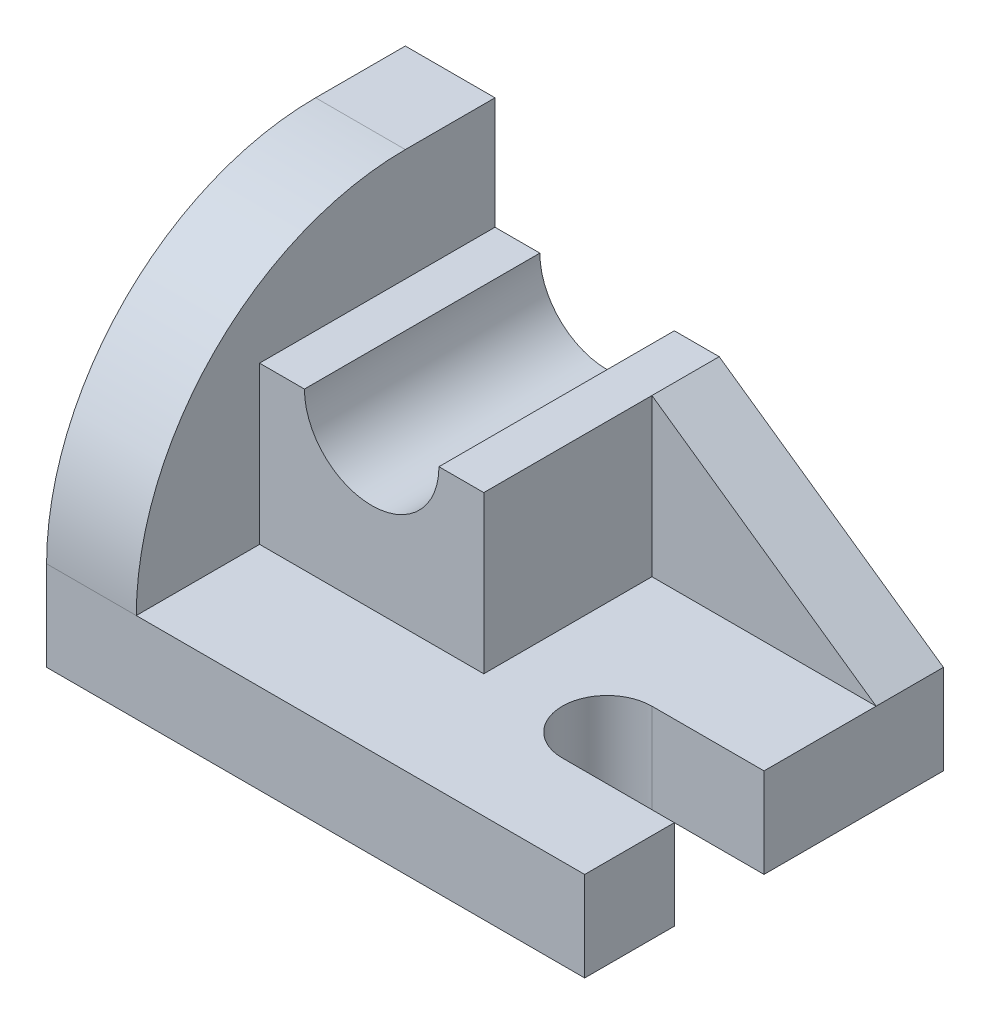
from build123d import *

# Parameters (mm, degrees)
BOSS_EXTRUDE5_DEPTH = 16
BOSS_EXTRUDE6_DEPTH = 16
BOSS_EXTRUDE7_DEPTH = 42
BOSS_EXTRUDE8_DEPTH = 12


with BuildPart() as part:
    # Sketch1 → Boss-Extrude5 (new body)
    with BuildSketch(Plane(origin=(0, 0, 0), x_dir=(1, 0, 0), z_dir=(0, 1, 0))):
        with BuildLine():
            Line((0, 0), (96, 0))
            Line((96, 0), (96, 16))
            Line((96, 16), (76, 16))
            ThreePointArc((76, 16), (68, 24), (76, 32))
            Line((76, 32), (96, 32))
            Line((96, 32), (96, 64))
            Line((96, 64), (0, 64))
            Line((0, 64), (0, 0))
        make_face()
    extrude(amount=BOSS_EXTRUDE5_DEPTH)

    # Sketch4 → Boss-Extrude6 (add)
    with BuildSketch(Plane.ZY):
        with BuildLine():
            Line((-64, 16), (0, 16))
            ThreePointArc((0, 16), (-14.058874503, 49.941125497), (-48, 64))
            Line((-48, 64), (-64, 64))
            Line((-64, 64), (-64, 16))
        make_face()
    extrude(amount=-BOSS_EXTRUDE6_DEPTH)

    # Sketch5 → Boss-Extrude7 (add)
    with BuildSketch(Plane(origin=(0, 0, -64), x_dir=(-1, 0, 0), z_dir=(0, 0, -1))):
        with BuildLine():
            Line((-48, 44), (-56, 44))
            Line((-56, 44), (-56, 16))
            Line((-56, 16), (-16, 16))
            Line((-16, 16), (-16, 44))
            Line((-16, 44), (-24, 44))
            ThreePointArc((-24, 44), (-36, 32), (-48, 44))
        make_face()
    extrude(amount=-BOSS_EXTRUDE7_DEPTH)

    # Sketch6 → Boss-Extrude8 (add)
    with BuildSketch(Plane(origin=(0, 0, -64), x_dir=(-1, 0, 0), z_dir=(0, 0, -1))):
        Polygon((-96, 16), (-56, 16), (-56, 44), align=None)
    extrude(amount=-BOSS_EXTRUDE8_DEPTH)


solid = part.part
